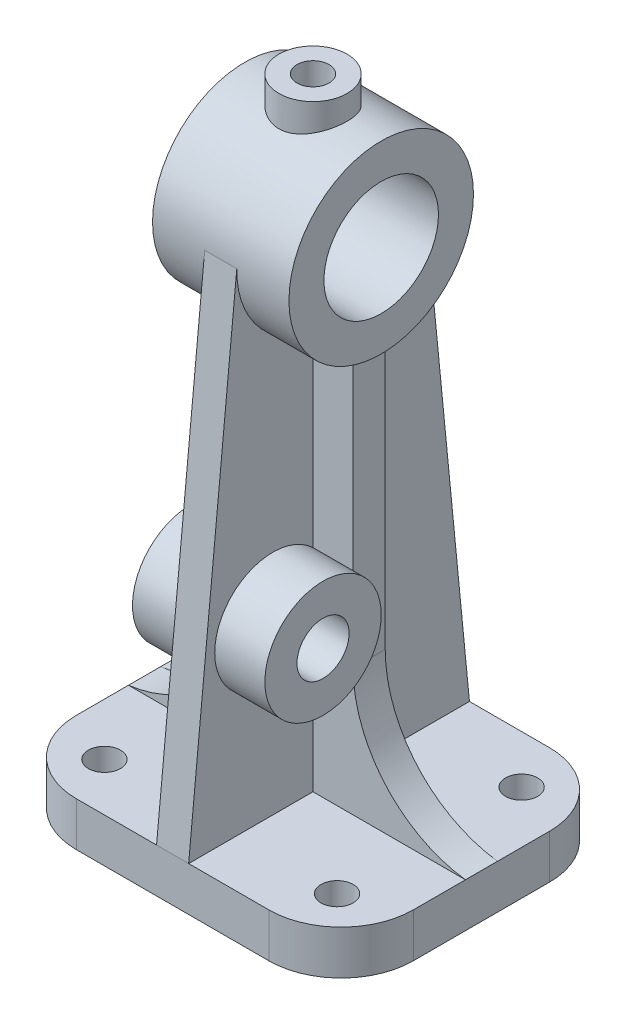
from build123d import *

# Parameters (mm, degrees)
BOSS_EXTRUDE1_DEPTH     = 11
SKETCH2_R               = 23
SKETCH2_R_2             = 14.275
BOSS_EXTRUDE2_DEPTH     = 17
BOSS_EXTRUDE3_DEPTH     = 4
SKETCH6_R               = 4
CUT_EXTRUDE1_DEPTH      = 155.964512066
BOSS_EXTRUDE4_REACH     = 172.977
SKETCH9_R               = 8.5
SKETCH9_R_2             = 4
CUT_EXTRUDE2_REACH      = 172.977
CUT_EXTRUDE2_END_RADIUS = 14.275
SKETCH9_3_R             = 4
BOSS_EXTRUDE5_DEPTH     = 4
SKETCH12_R              = 14.5
SKETCH12_R_2            = 6.5
BOSS_EXTRUDE6_DEPTH     = 16.5
CUT_EXTRUDE3_DEPTH      = 171.976606706
CUT_EXTRUDE3_DEPTH_BACK = 171.976606706
SKETCH12_2_R            = 6.5


with BuildPart() as part:
    # Sketch1 → Boss-Extrude1 (new body)
    with BuildSketch(Plane(origin=(0, 0, 0), x_dir=(1, 0, 0), z_dir=(0, 1, 0))):
        with BuildLine():
            Line((-24, -35), (24, -35))
            ThreePointArc((24, -35), (36.727922061, -29.727922061), (42, -17))
            Line((42, -17), (42, 17))
            ThreePointArc((42, 17), (36.727922061, 29.727922061), (24, 35))
            Line((24, 35), (-24, 35))
            ThreePointArc((-24, 35), (-36.727922061, 29.727922061), (-42, 17))
            Line((-42, 17), (-42, -17))
            ThreePointArc((-42, -17), (-36.727922061, -29.727922061), (-24, -35))
        make_face()
    extrude(amount=BOSS_EXTRUDE1_DEPTH)



with BuildPart() as body_2:
    # Sketch2 → Boss-Extrude2 (new, symmetric)
    with BuildSketch(Plane(origin=(0, 0, 0), x_dir=(0, 0, -1), z_dir=(1, 0, 0))):
        with Locations((0, 133)):
            Circle(SKETCH2_R)
        with Locations((0, 133)):
            Circle(SKETCH2_R_2, mode=Mode.SUBTRACT)
    extrude(amount=BOSS_EXTRUDE2_DEPTH, both=True)


with BuildPart() as part_1:
    add(part.part)

    add(body_2.part)  # Boss-Extrude3 merges body 2
    # Sketch3 → Boss-Extrude3 (add, symmetric)
    with BuildSketch(Plane(origin=(0, 0, 0), x_dir=(0, 0, -1), z_dir=(1, 0, 0))):
        with BuildLine():
            Line((-35, 11), (-22.996293992, 133.412871227))
            ThreePointArc((-22.996293992, 133.412871227), (0, 110), (22.996293992, 133.412871227))
            Line((22.996293992, 133.412871227), (35, 11))
            Line((35, 11), (-35, 11))
        make_face()
    extrude(amount=BOSS_EXTRUDE3_DEPTH, both=True)

    # Sketch6 → Cut-Extrude1 (cut, through all)
    with BuildSketch(Plane(origin=(0, 11, 0), x_dir=(1, 0, 0), z_dir=(0, 1, 0))):
        with Locations((29, -23)):
            Circle(SKETCH6_R)
        with Locations((29, 23)):
            Circle(SKETCH6_R)
        with Locations((-29, -23)):
            Circle(SKETCH6_R)
        with Locations((-29, 23)):
            Circle(SKETCH6_R)
    extrude(amount=-CUT_EXTRUDE1_DEPTH, mode=Mode.SUBTRACT)

    # Sketch9 → Boss-Extrude4 (add, up to next)
    with BuildSketch(Plane(origin=(0, 162, 0), x_dir=(-1, 0, 0), z_dir=(0, -1, 0)), mode=Mode.PRIVATE) as boss_extrude4_sk1:
        Circle(SKETCH9_R)
        Circle(SKETCH9_R_2, mode=Mode.SUBTRACT)
    boss_extrude4_tool1 = extrude(boss_extrude4_sk1.sketch, amount=BOSS_EXTRUDE4_REACH, mode=Mode.PRIVATE) - part_1.part
    add(boss_extrude4_tool1.solids().sort_by_distance((8.259584, 162, 0))[0])

    # Cut-Extrude2: up to this cylinder (the profile starts outside it)
    cut_extrude2_end = Plane(origin=(0, 133, 0), z_dir=(-1, 0, 0)) * Cylinder(CUT_EXTRUDE2_END_RADIUS, 375.504, mode=Mode.PRIVATE)
    # Sketch9<3> → Cut-Extrude2 (cut, up to the surface)
    with BuildSketch(Plane(origin=(0, 162, 0), x_dir=(-1, 0, 0), z_dir=(0, -1, 0)), mode=Mode.PRIVATE) as cut_extrude2_sk1:
        Circle(SKETCH9_3_R)
    cut_extrude2_tool1 = extrude(cut_extrude2_sk1.sketch, amount=CUT_EXTRUDE2_REACH, mode=Mode.PRIVATE) - cut_extrude2_end
    add(cut_extrude2_tool1.solids().sort_by_distance((0, 162, 0))[0], mode=Mode.SUBTRACT)

    # Sketch10 → Boss-Extrude5 (add, symmetric)
    with BuildSketch(Plane.XY):
        with BuildLine():
            Line((14, 113), (14, 42.749015733))
            ThreePointArc((14, 42.749015733), (22, 21.583005244), (42, 11))
            Line((42, 11), (4, 11))
            Line((4, 11), (4, 113))
            Line((4, 113), (14, 113))
        make_face()
    boss_extrude5 = extrude(amount=BOSS_EXTRUDE5_DEPTH, both=True)

    # Mirror1: Boss-Extrude5 across plane
    add(boss_extrude5.mirror(Plane(origin=(0, 0, 0), x_dir=(0, 0, 1), z_dir=(1, 0, 0))))

    # Sketch12 → Boss-Extrude6 (add, symmetric)
    with BuildSketch(Plane(origin=(0, 0, 0), x_dir=(0, 0, -1), z_dir=(1, 0, 0))):
        with Locations((-14, 53.219049893)):
            Circle(SKETCH12_R)
        with Locations((-14, 53.219049893)):
            Circle(SKETCH12_R_2, mode=Mode.SUBTRACT)
    extrude(amount=BOSS_EXTRUDE6_DEPTH, both=True)

    # Sketch12<2> → Cut-Extrude3 (cut, two sides: drawn at the far end of the back side and taken through both)
    with BuildSketch(Plane(origin=(0, 0, 0), x_dir=(0, 0, -1), z_dir=(1, 0, 0)).offset(-CUT_EXTRUDE3_DEPTH_BACK)):
        with Locations((-14, 53.219049893)):
            Circle(SKETCH12_2_R)
    extrude(amount=CUT_EXTRUDE3_DEPTH + CUT_EXTRUDE3_DEPTH_BACK, mode=Mode.SUBTRACT)


solid = part_1.part
